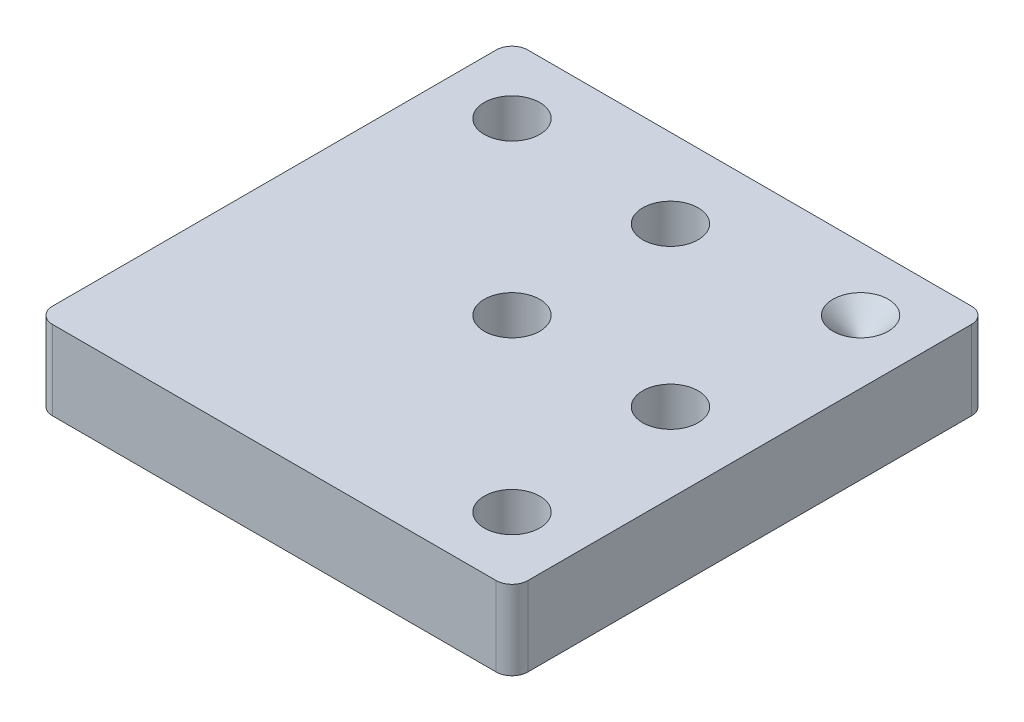
from build123d import *

# Parameters (mm, degrees)
SKETCH1_W           = 76.2
SKETCH1_H           = 76.2
BOSS_EXTRUDE1_DEPTH = 12.7
CUT_EXTRUDE1_REACH  = 57.358
SKETCH2_R           = 4.445
CUT_EXTRUDE2_REACH  = 57.358
SKETCH6_R           = 4.445
SKETCH7_R           = 4.445
CUT_EXTRUDE3_DEPTH  = 3.81
CUT_EXTRUDE3_DRAFT  = -45
CUT_EXTRUDE4_REACH  = 57.358
SKETCH12_R          = 4.445
SKETCH13_R          = 6.858
CUT_EXTRUDE5_DEPTH  = 3.81
FILLET1_R           = 2.54


with BuildPart() as part:
    # Sketch1 → Boss-Extrude1 (new body)
    with BuildSketch(Plane(origin=(0, 0, 0), x_dir=(1, 0, 0), z_dir=(0, 1, 0))):
        Rectangle(SKETCH1_W, SKETCH1_H)
    extrude(amount=BOSS_EXTRUDE1_DEPTH)

    # Sketch2 → Cut-Extrude1 (cut, up to next)
    with BuildSketch(Plane.XZ, mode=Mode.PRIVATE) as cut_extrude1_sk1:
        with Locations(Location((0, 0, 0), (0, 0, 270))):
            Circle(SKETCH2_R)
    cut_extrude1_tool1 = extrude(cut_extrude1_sk1.sketch, amount=-CUT_EXTRUDE1_REACH, mode=Mode.PRIVATE) & part.part
    add(cut_extrude1_tool1.solids().sort_by_distance((0, 0, 0))[0], mode=Mode.SUBTRACT)

    # Sketch6 → Cut-Extrude2 (cut, up to next)
    with BuildSketch(Plane(origin=(0, 12.7, 0), x_dir=(1, 0, 0), z_dir=(0, 1, 0)), mode=Mode.PRIVATE) as cut_extrude2_sk1:
        with Locations(Location((-27.323692655, 27.323692655, 0), (0, 0, 270))):
            Circle(SKETCH6_R)
    cut_extrude2_tool1 = extrude(cut_extrude2_sk1.sketch, amount=-CUT_EXTRUDE2_REACH, mode=Mode.PRIVATE) & part.part
    # Sketch6 → Cut-Extrude2 (cut, up to next)
    with BuildSketch(Plane(origin=(0, 12.7, 0), x_dir=(1, 0, 0), z_dir=(0, 1, 0)), mode=Mode.PRIVATE) as cut_extrude2_sk2:
        with Locations(Location((27.323692655, -27.323692655, 0), (0, 0, 270))):
            Circle(SKETCH6_R)
    cut_extrude2_tool2 = extrude(cut_extrude2_sk2.sketch, amount=-CUT_EXTRUDE2_REACH, mode=Mode.PRIVATE) & part.part
    add(cut_extrude2_tool1.solids().sort_by_distance((-27.323693, 12.7, -27.323693))[0], mode=Mode.SUBTRACT)
    add(cut_extrude2_tool2.solids().sort_by_distance((27.323693, 12.7, 27.323693))[0], mode=Mode.SUBTRACT)


with BuildPart() as cut_extrude3_tool:
    # Sketch7 → Cut-Extrude3 (with draft: the straight prism first)
    with BuildSketch(Plane(origin=(0, 12.7, 0), x_dir=(1, 0, 0), z_dir=(0, 1, 0))):
        with Locations((27.94, 27.94)):
            Circle(SKETCH7_R)
    extrude(amount=-CUT_EXTRUDE3_DEPTH)
    # Cut-Extrude3: the draft: its side faces are tilted about the plane it starts from
    cut_extrude3_sides = [cut_extrude3_tool.faces().sort_by_distance(p)[0] for p in [
        (23.495, 10.795, -27.94),
    ]]
    draft(cut_extrude3_sides, Plane(origin=(0, 12.7, 0), x_dir=(1, 0, 0), z_dir=(0, 1, 0)), CUT_EXTRUDE3_DRAFT)


with BuildPart() as part_1:
    add(part.part)

    # Cut-Extrude3: cut by cut_extrude3_tool
    add(cut_extrude3_tool.part, mode=Mode.SUBTRACT)

    # Sketch12 → Cut-Extrude4 (cut, up to next)
    with BuildSketch(Plane(origin=(0, 12.7, 0), x_dir=(1, 0, 0), z_dir=(0, 1, 0)), mode=Mode.PRIVATE) as cut_extrude4_sk1:
        with Locations(Location((0, 25.4, 0), (0, 0, 270))):
            Circle(SKETCH12_R)
    cut_extrude4_tool1 = extrude(cut_extrude4_sk1.sketch, amount=-CUT_EXTRUDE4_REACH, mode=Mode.PRIVATE) & part_1.part
    # Sketch12 → Cut-Extrude4 (cut, up to next)
    with BuildSketch(Plane(origin=(0, 12.7, 0), x_dir=(1, 0, 0), z_dir=(0, 1, 0)), mode=Mode.PRIVATE) as cut_extrude4_sk2:
        with Locations(Location((25.4, 0, 0), (0, 0, 270))):
            Circle(SKETCH12_R)
    cut_extrude4_tool2 = extrude(cut_extrude4_sk2.sketch, amount=-CUT_EXTRUDE4_REACH, mode=Mode.PRIVATE) & part_1.part
    add(cut_extrude4_tool1.solids().sort_by_distance((0, 12.7, -25.4))[0], mode=Mode.SUBTRACT)
    add(cut_extrude4_tool2.solids().sort_by_distance((25.4, 12.7, 0))[0], mode=Mode.SUBTRACT)

    # Sketch13 → Cut-Extrude5 (cut)
    with BuildSketch(Plane.XZ):
        with Locations(Location((0, -25.4, 0), (0, 0, 270))):
            Circle(SKETCH13_R)
        with Locations(Location((25.4, 0, 0), (0, 0, 270))):
            Circle(SKETCH13_R)
    extrude(amount=-CUT_EXTRUDE5_DEPTH, mode=Mode.SUBTRACT)

    # Fillet1
    fillet1_edges = [part_1.edges().sort_by_distance(p)[0] for p in [
        (38.1, 6.35, 38.1),
        (-38.1, 6.35, 38.1),
        (-38.1, 6.35, -38.1),
        (38.1, 6.35, -38.1),
    ]]
    fillet(fillet1_edges, radius=FILLET1_R)


solid = part_1.part
